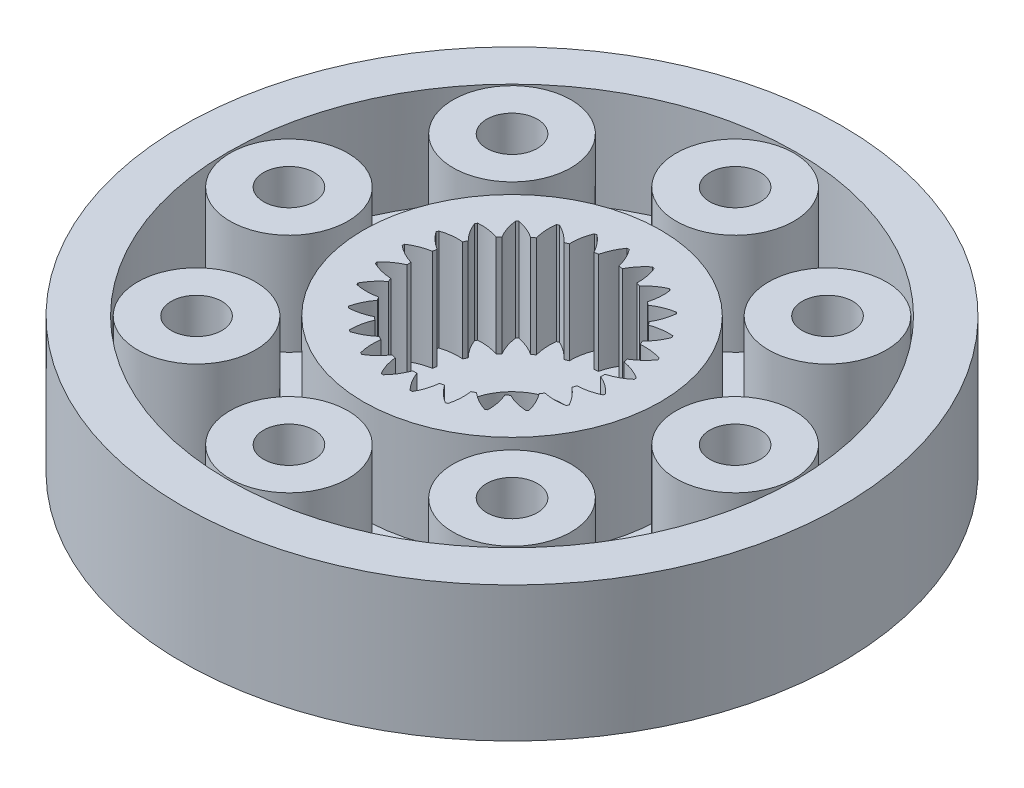
from build123d import *

# Parameters (mm, degrees)
SKETCH_1_R          = 9.75
EXTRUDE_1_DEPTH     = 3
EXTRUDE_START       = 1
SKETCH_2_R          = 9.75
EXTRUDE_2_DEPTH     = 1
SKETCH_4_R          = 1.5
CUT_EXTRUDE_4_DEPTH = 1
SKETCH_5_R          = 8.4
SKETCH_5_R_2        = 4.4
CUT_EXTRUDE_5_DEPTH = 10
SKETCH_6_R          = 1.744482362
SKETCH_6_R_2        = 0.75
EXTRUDE_3_DEPTH     = 3
SKETCH_7_R          = 0.75
SKETCH_7_R_2        = 1.5
CUT_EXTRUDE_6_DEPTH = 3


with BuildPart() as part:
    # 草图1 → 凸台-拉伸1 (new body)
    with BuildSketch(Plane(origin=(0, 0, 0), x_dir=(1, 0, 0), z_dir=(0, 1, 0))):
        with Locations(Location((0.394660743, -0.591991115, 0), (0, 0, 270))):
            Circle(SKETCH_1_R)
        with BuildLine():
            ThreePointArc((-0.026116093, 2.25205035), (-0.201664975, 2.520045602), (-0.42818362, 2.746602811))
            ThreePointArc((-0.42818362, 2.746602811), (-0.460459434, 2.738482084), (-0.492655135, 2.73004934))
            ThreePointArc((-0.492655135, 2.73004934), (-0.582010169, 2.422389555), (-0.606737129, 2.102972206))
            ThreePointArc((-0.606737129, 2.102972206), (-0.663697346, 2.081116282), (-0.720180966, 2.058056613))
            ThreePointArc((-0.720180966, 2.058056613), (-0.956862366, 2.27397507), (-1.232606998, 2.437081672))
            ThreePointArc((-1.232606998, 2.437081672), (-1.261849265, 2.421189404), (-1.290936341, 2.405014844))
            ThreePointArc((-1.290936341, 2.405014844), (-1.300972245, 2.084799064), (-1.245486498, 1.769267453))
            ThreePointArc((-1.245486498, 1.769267453), (-1.295221857, 1.733932744), (-1.344196234, 1.697550632))
            ThreePointArc((-1.344196234, 1.697550632), (-1.62713859, 1.847825343), (-1.934783159, 1.937232749))
            ThreePointArc((-1.934783159, 1.937232749), (-1.95915448, 1.91456751), (-1.983305283, 1.891667442))
            ThreePointArc((-1.983305283, 1.891667442), (-1.913391464, 1.579016002), (-1.781179383, 1.287196141))
            ThreePointArc((-1.781179383, 1.287196141), (-1.82056483, 1.240602855), (-1.858952723, 1.193184322))
            ThreePointArc((-1.858952723, 1.193184322), (-2.170377725, 1.268372974), (-2.490591793, 1.278463389))
            ThreePointArc((-2.490591793, 1.278463389), (-2.508560828, 1.250449319), (-2.526257873, 1.222262639))
            ThreePointArc((-2.526257873, 1.222262639), (-2.380787274, 0.936820578), (-2.180156231, 0.687048582))
            ThreePointArc((-2.180156231, 0.687048582), (-2.206717032, 0.632124348), (-2.23210639, 0.576648875))
            ThreePointArc((-2.23210639, 0.576648875), (-2.552446061, 0.572027088), (-2.865109398, 0.502166494))
            ThreePointArc((-2.865109398, 0.502166494), (-2.875547088, 0.47056382), (-2.885678405, 0.4388616))
            ThreePointArc((-2.885678405, 0.4388616), (-2.673791479, 0.198564293), (-2.417347859, 0.006534255))
            ThreePointArc((-2.417347859, 0.006534255), (-2.429415102, -0.053269836), (-2.440210618, -0.113316522))
            ThreePointArc((-2.440210618, -0.113316522), (-2.749336837, -0.197458343), (-3.034803657, -0.342880348))
            ThreePointArc((-3.034803657, -0.342880348), (-3.037054162, -0.376085914), (-3.038983164, -0.409311707))
            ThreePointArc((-3.038983164, -0.409311707), (-2.773993545, -0.589365496), (-2.477850645, -0.711587622))
            ThreePointArc((-2.477850645, -0.711587622), (-2.474666101, -0.772513859), (-2.470189451, -0.833358803))
            ThreePointArc((-2.470189451, -0.833358803), (-2.748678682, -0.991733719), (-2.989012055, -1.203579736))
            ThreePointArc((-2.989012055, -1.203579736), (-2.982933968, -1.236301765), (-2.976539448, -1.268963432))
            ThreePointArc((-2.976539448, -1.268963432), (-2.675097409, -1.377460262), (-2.357862976, -1.422194811))
            ThreePointArc((-2.357862976, -1.422194811), (-2.339626741, -1.480414974), (-2.320159211, -1.538235065))
            ThreePointArc((-2.320159211, -1.538235065), (-2.550512951, -1.760891797), (-2.730611847, -2.025850761))
            ThreePointArc((-2.730611847, -2.025850761), (-2.716587076, -2.056033209), (-2.702270826, -2.086078497))
            ThreePointArc((-2.702270826, -2.086078497), (-2.383317078, -2.116201113), (-2.064924118, -2.080637248))
            ThreePointArc((-2.064924118, -2.080637248), (-2.032782042, -2.132493151), (-1.999546849, -2.18365534))
            ThreePointArc((-1.999546849, -2.18365534), (-2.167291125, -2.456603546), (-2.275839268, -2.758027112))
            ThreePointArc((-2.275839268, -2.758027112), (-2.254749042, -2.783773504), (-2.233410603, -2.809314557))
            ThreePointArc((-2.233410603, -2.809314557), (-1.916986184, -2.759170244), (-1.617440498, -2.645542574))
            ThreePointArc((-1.617440498, -2.645542574), (-1.573412186, -2.687775919), (-1.528497619, -2.729065497))
            ThreePointArc((-1.528497619, -2.729065497), (-1.623092441, -3.035154839), (-1.653269352, -3.354103454))
            ThreePointArc((-1.653269352, -3.354103454), (-1.626438847, -3.37379605), (-1.599418993, -3.393228031))
            ThreePointArc((-1.599418993, -3.393228031), (-1.305406012, -3.26596754), (-1.043529157, -3.081415709))
            ThreePointArc((-1.043529157, -3.081415709), (-0.99038107, -3.11137282), (-0.936609275, -3.140195412))
            ThreePointArc((-0.936609275, -3.140195412), (-0.952110903, -3.460193169), (-0.902020456, -3.77662612))
            ThreePointArc((-0.902020456, -3.77662612), (-0.871135531, -3.789027562), (-0.840132018, -3.801129486))
            ThreePointArc((-0.840132018, -3.801129486), (-0.587004393, -3.604749063), (-0.379251055, -3.360869142))
            ThreePointArc((-0.379251055, -3.360869142), (-0.320322682, -3.376667703), (-0.261072341, -3.391212279))
            ThreePointArc((-0.261072341, -3.391212279), (-0.19650675, -3.705011816), (-0.069296312, -3.999046457))
            ThreePointArc((-0.069296312, -3.999046457), (-0.03629758, -4.003377516), (-0.003258474, -4.007388976))
            ThreePointArc((-0.003258474, -4.007388976), (0.193078856, -3.754227924), (0.333654771, -3.466343785))
            ThreePointArc((0.333654771, -3.466343785), (0.394660743, -3.466991115), (0.455666715, -3.466343785))
            ThreePointArc((0.455666715, -3.466343785), (0.596242631, -3.754227924), (0.792579961, -4.007388976))
            ThreePointArc((0.792579961, -4.007388976), (0.825619067, -4.003377516), (0.858617799, -3.999046457))
            ThreePointArc((0.858617799, -3.999046457), (0.985828237, -3.705011816), (1.050393827, -3.391212279))
            ThreePointArc((1.050393827, -3.391212279), (1.109644169, -3.376667703), (1.168572542, -3.360869142))
            ThreePointArc((1.168572542, -3.360869142), (1.37632588, -3.604749063), (1.629453505, -3.801129486))
            ThreePointArc((1.629453505, -3.801129486), (1.660457018, -3.789027562), (1.691341943, -3.77662612))
            ThreePointArc((1.691341943, -3.77662612), (1.74143239, -3.460193169), (1.725930762, -3.140195412))
            ThreePointArc((1.725930762, -3.140195412), (1.779702556, -3.11137282), (1.832850644, -3.081415709))
            ThreePointArc((1.832850644, -3.081415709), (2.094727499, -3.26596754), (2.388740479, -3.393228031))
            ThreePointArc((2.388740479, -3.393228031), (2.415760333, -3.37379605), (2.442590839, -3.354103454))
            ThreePointArc((2.442590839, -3.354103454), (2.412413927, -3.035154839), (2.317819105, -2.729065497))
            ThreePointArc((2.317819105, -2.729065497), (2.362733673, -2.687775919), (2.406761985, -2.645542574))
            ThreePointArc((2.406761985, -2.645542574), (2.706307671, -2.759170244), (3.02273209, -2.809314557))
            ThreePointArc((3.02273209, -2.809314557), (3.044070529, -2.783773504), (3.065160755, -2.758027112))
            ThreePointArc((3.065160755, -2.758027112), (2.956612612, -2.456603546), (2.788868336, -2.18365534))
            ThreePointArc((2.788868336, -2.18365534), (2.822103529, -2.132493151), (2.854245605, -2.080637248))
            ThreePointArc((2.854245605, -2.080637248), (3.172638565, -2.116201113), (3.491592313, -2.086078497))
            ThreePointArc((3.491592313, -2.086078497), (3.505908563, -2.056033209), (3.519933334, -2.025850761))
            ThreePointArc((3.519933334, -2.025850761), (3.339834438, -1.760891797), (3.109480698, -1.538235065))
            ThreePointArc((3.109480698, -1.538235065), (3.128948228, -1.480414974), (3.147184462, -1.422194811))
            ThreePointArc((3.147184462, -1.422194811), (3.464418895, -1.377460262), (3.765860935, -1.268963432))
            ThreePointArc((3.765860935, -1.268963432), (3.772255455, -1.236301765), (3.778333542, -1.203579736))
            ThreePointArc((3.778333542, -1.203579736), (3.538000169, -0.991733719), (3.259510938, -0.833358803))
            ThreePointArc((3.259510938, -0.833358803), (3.263987588, -0.772513859), (3.267172132, -0.711587622))
            ThreePointArc((3.267172132, -0.711587622), (3.563315032, -0.589365496), (3.828304651, -0.409311707))
            ThreePointArc((3.828304651, -0.409311707), (3.826375649, -0.376085914), (3.824125144, -0.342880348))
            ThreePointArc((3.824125144, -0.342880348), (3.538658323, -0.197458343), (3.229532104, -0.113316522))
            ThreePointArc((3.229532104, -0.113316522), (3.218736589, -0.053269836), (3.206669346, 0.006534255))
            ThreePointArc((3.206669346, 0.006534255), (3.463112965, 0.198564293), (3.674999892, 0.4388616))
            ThreePointArc((3.674999892, 0.4388616), (3.664868575, 0.47056382), (3.654430885, 0.502166494))
            ThreePointArc((3.654430885, 0.502166494), (3.341767547, 0.572027088), (3.021427877, 0.576648875))
            ThreePointArc((3.021427877, 0.576648875), (2.996038519, 0.632124348), (2.969477718, 0.687048582))
            ThreePointArc((2.969477718, 0.687048582), (3.170108761, 0.936820578), (3.31557936, 1.222262639))
            ThreePointArc((3.31557936, 1.222262639), (3.297882315, 1.250449319), (3.279913279, 1.278463389))
            ThreePointArc((3.279913279, 1.278463389), (2.959699212, 1.268372974), (2.64827421, 1.193184322))
            ThreePointArc((2.64827421, 1.193184322), (2.609886316, 1.240602855), (2.57050087, 1.287196141))
            ThreePointArc((2.57050087, 1.287196141), (2.702712951, 1.579016002), (2.772626769, 1.891667442))
            ThreePointArc((2.772626769, 1.891667442), (2.748475967, 1.91456751), (2.724104646, 1.937232749))
            ThreePointArc((2.724104646, 1.937232749), (2.416460076, 1.847825343), (2.133517721, 1.697550632))
            ThreePointArc((2.133517721, 1.697550632), (2.084543344, 1.733932744), (2.034807985, 1.769267453))
            ThreePointArc((2.034807985, 1.769267453), (2.090293731, 2.084799064), (2.080257828, 2.405014844))
            ThreePointArc((2.080257828, 2.405014844), (2.051170752, 2.421189404), (2.021928485, 2.437081672))
            ThreePointArc((2.021928485, 2.437081672), (1.746183853, 2.27397507), (1.509502453, 2.058056613))
            ThreePointArc((1.509502453, 2.058056613), (1.453018832, 2.081116282), (1.396058616, 2.102972206))
            ThreePointArc((1.396058616, 2.102972206), (1.371331655, 2.422389555), (1.281976622, 2.73004934))
            ThreePointArc((1.281976622, 2.73004934), (1.24978092, 2.738482084), (1.217505107, 2.746602811))
            ThreePointArc((1.217505107, 2.746602811), (0.990986462, 2.520045602), (0.81543758, 2.25205035))
            ThreePointArc((0.81543758, 2.25205035), (0.75499379, 2.260338651), (0.694387736, 2.267342501))
            ThreePointArc((0.694387736, 2.267342501), (0.591001754, 2.570575422), (0.427942096, 2.846347815))
            ThreePointArc((0.427942096, 2.846347815), (0.394660743, 2.846508885), (0.361379391, 2.846347815))
            ThreePointArc((0.361379391, 2.846347815), (0.198319733, 2.570575422), (0.094933751, 2.267342501))
            ThreePointArc((0.094933751, 2.267342501), (0.034327697, 2.260338651), (-0.026116093, 2.25205035))
        make_face(mode=Mode.SUBTRACT)
    extrude(amount=EXTRUDE_1_DEPTH)

    # 草图2 → 凸台-拉伸2 (add)
    with BuildSketch(Plane(origin=(0, 0, 0), x_dir=(-1, 0, 0), z_dir=(0, -1, 0)).offset(EXTRUDE_START)):
        with Locations(Location((-0.394660743, -0.591991115, 0), (0, 0, 90))):
            Circle(SKETCH_2_R)
    extrude(amount=-EXTRUDE_2_DEPTH)

    # 草图4 → 切除-拉伸4 (cut)
    with BuildSketch(Plane(origin=(0, 0, 0), x_dir=(1, 0, 0), z_dir=(0, 1, 0))):
        with Locations(Location((0.394660743, -0.591991115, 0), (0, 0, 270))):
            Circle(SKETCH_4_R)
    extrude(amount=-CUT_EXTRUDE_4_DEPTH, mode=Mode.SUBTRACT)

    # 草图5 → 切除-拉伸5 (cut)
    with BuildSketch(Plane(origin=(0, 0, 0), x_dir=(-1, 0, 0), z_dir=(0, -1, 0))):
        with Locations(Location((-0.394660743, -0.591991115, 0), (0, 0, 90))):
            Circle(SKETCH_5_R)
        with Locations(Location((-0.394660743, -0.591991115, 0), (0, 0, 90))):
            Circle(SKETCH_5_R_2, mode=Mode.SUBTRACT)
    extrude(amount=-CUT_EXTRUDE_5_DEPTH, mode=Mode.SUBTRACT)

    # 草图6 → 凸台-拉伸3 (add)
    # profile 1 of 8: a face of its own
    with BuildSketch(Plane(origin=(0, 0, 0), x_dir=(-1, 0, 0), z_dir=(0, -1, 0))):
        with Locations(Location((-0.394660743, 6.008008885, 0), (0, 0, 90))):
            Circle(SKETCH_6_R)
        with Locations(Location((-0.394660743, 6.008008885, 0), (0, 0, 90))):
            Circle(SKETCH_6_R_2, mode=Mode.SUBTRACT)
    # profile 2 of 8: a face of its own
    with BuildSketch(Plane(origin=(0, 0, 0), x_dir=(-1, 0, 0), z_dir=(0, -1, 0))):
        with Locations(Location((4.272244012, 4.074913641, 0), (0, 0, 90))):
            Circle(SKETCH_6_R)
        with Locations(Location((4.272244012, 4.074913641, 0), (0, 0, 90))):
            Circle(SKETCH_6_R_2, mode=Mode.SUBTRACT)
    # profile 3 of 8: a face of its own
    with BuildSketch(Plane(origin=(0, 0, 0), x_dir=(-1, 0, 0), z_dir=(0, -1, 0))):
        with Locations(Location((6.205339257, -0.591991115, 0), (0, 0, 90))):
            Circle(SKETCH_6_R)
        with Locations(Location((6.205339257, -0.591991115, 0), (0, 0, 90))):
            Circle(SKETCH_6_R_2, mode=Mode.SUBTRACT)
    # profile 4 of 8: a face of its own
    with BuildSketch(Plane(origin=(0, 0, 0), x_dir=(-1, 0, 0), z_dir=(0, -1, 0))):
        with Locations(Location((4.272244012, -5.258895871, 0), (0, 0, 90))):
            Circle(SKETCH_6_R)
        with Locations(Location((4.272244012, -5.258895871, 0), (0, 0, 90))):
            Circle(SKETCH_6_R_2, mode=Mode.SUBTRACT)
    # profile 5 of 8: a face of its own
    with BuildSketch(Plane(origin=(0, 0, 0), x_dir=(-1, 0, 0), z_dir=(0, -1, 0))):
        with Locations(Location((-0.394660743, -7.191991115, 0), (0, 0, 90))):
            Circle(SKETCH_6_R)
        with Locations(Location((-0.394660743, -7.191991115, 0), (0, 0, 90))):
            Circle(SKETCH_6_R_2, mode=Mode.SUBTRACT)
    # profile 6 of 8: a face of its own
    with BuildSketch(Plane(origin=(0, 0, 0), x_dir=(-1, 0, 0), z_dir=(0, -1, 0))):
        with Locations(Location((-5.061565499, -5.258895871, 0), (0, 0, 90))):
            Circle(SKETCH_6_R)
        with Locations(Location((-5.061565499, -5.258895871, 0), (0, 0, 90))):
            Circle(SKETCH_6_R_2, mode=Mode.SUBTRACT)
    # profile 7 of 8: a face of its own
    with BuildSketch(Plane(origin=(0, 0, 0), x_dir=(-1, 0, 0), z_dir=(0, -1, 0))):
        with Locations(Location((-6.994660743, -0.591991115, 0), (0, 0, 90))):
            Circle(SKETCH_6_R)
        with Locations(Location((-6.994660743, -0.591991115, 0), (0, 0, 90))):
            Circle(SKETCH_6_R_2, mode=Mode.SUBTRACT)
    # profile 8 of 8: a face of its own
    with BuildSketch(Plane(origin=(0, 0, 0), x_dir=(-1, 0, 0), z_dir=(0, -1, 0))):
        with Locations(Location((-5.061565499, 4.074913641, 0), (0, 0, 90))):
            Circle(SKETCH_6_R)
        with Locations(Location((-5.061565499, 4.074913641, 0), (0, 0, 90))):
            Circle(SKETCH_6_R_2, mode=Mode.SUBTRACT)
    extrude(amount=-EXTRUDE_3_DEPTH)

    # 草图7 → 切除-拉伸6 (cut)
    with BuildSketch(Plane(origin=(0, -1, 0), x_dir=(-1, 0, 0), z_dir=(0, -1, 0))):
        with Locations(Location((-0.394660743, 6.008008885, 0), (0, 0, 90))):
            Circle(SKETCH_7_R)
        with Locations(Location((-0.394660743, -0.591991115, 0), (0, 0, 270))):
            Circle(SKETCH_7_R_2)
        with Locations(Location((4.272244012, 4.074913641, 0), (0, 0, 90))):
            Circle(SKETCH_7_R)
        with Locations(Location((6.205339257, -0.591991115, 0), (0, 0, 90))):
            Circle(SKETCH_7_R)
        with Locations(Location((4.272244012, -5.258895871, 0), (0, 0, 90))):
            Circle(SKETCH_7_R)
        with Locations(Location((-0.394660743, -7.191991115, 0), (0, 0, 90))):
            Circle(SKETCH_7_R)
        with Locations(Location((-5.061565499, -5.258895871, 0), (0, 0, 90))):
            Circle(SKETCH_7_R)
        with Locations(Location((-6.994660743, -0.591991115, 0), (0, 0, 90))):
            Circle(SKETCH_7_R)
        with Locations(Location((-5.061565499, 4.074913641, 0), (0, 0, 90))):
            Circle(SKETCH_7_R)
    extrude(amount=-CUT_EXTRUDE_6_DEPTH, mode=Mode.SUBTRACT)


solid = part.part
